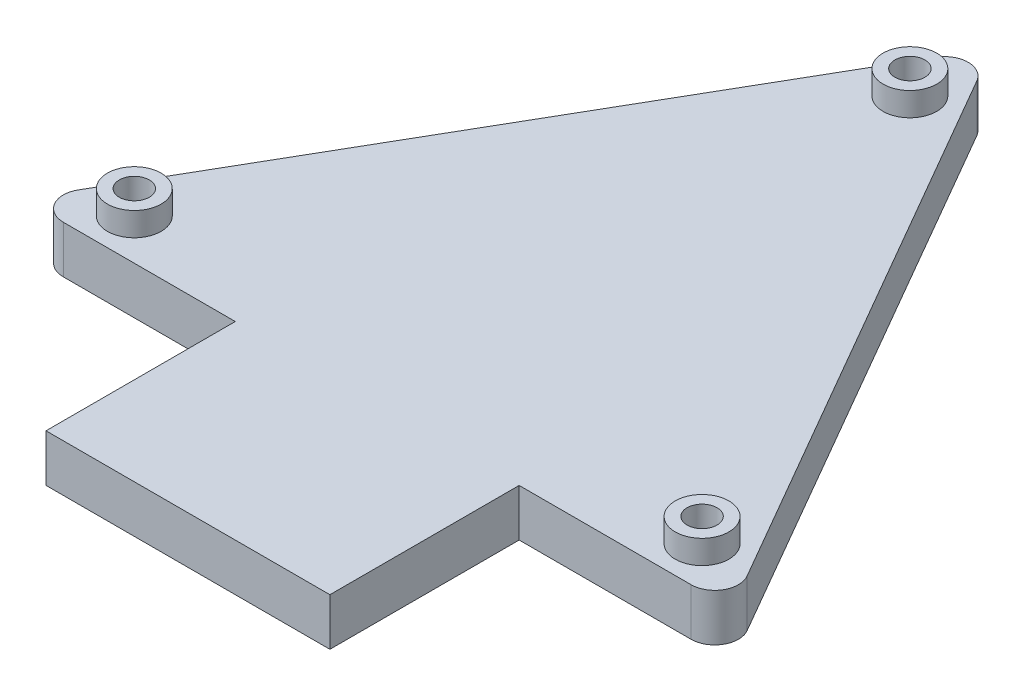
from build123d import *

# Parameters (mm, degrees)
SKETCH1_R           = 3.175
BOSS_EXTRUDE5_DEPTH = 10
SKETCH7_R           = 5.675
SKETCH7_R_2         = 3.175
BOSS_EXTRUDE7_DEPTH = 5


with BuildPart() as part:
    # Sketch1 → Boss-Extrude5 (new body)
    with BuildSketch(Plane(origin=(0, 0, 0), x_dir=(1, 0, 0), z_dir=(0, 1, 0))):
        with BuildLine():
            Line((4.330127019, 7.5), (70.669872981, 122.403810568))
            ThreePointArc((70.669872981, 122.403810568), (75, 124.903810568), (79.330127019, 122.403810568))
            Line((79.330127019, 122.403810568), (145.669872981, 7.5))
            ThreePointArc((145.669872981, 7.5), (145.669873, 2.500000033), (141.339746038, 0))
            Line((141.339746038, 0), (105.000000038, 0))
            Line((105.000000038, 0), (105.000000038, -40))
            Line((105.000000038, -40), (45.000000038, -40))
            Line((45.000000038, -40), (45.000000038, 0))
            Line((45.000000038, 0), (8.660254038, 0))
            ThreePointArc((8.660254038, 0), (4.330127019, 2.5), (4.330127019, 7.5))
        make_face()
        with Locations(Location((75, 112.583302492, 0), (0, 0, 270))):
            Circle(SKETCH1_R, mode=Mode.SUBTRACT)
        with Locations(Location((15, 8.660254038, 0), (0, 0, 270))):
            Circle(SKETCH1_R, mode=Mode.SUBTRACT)
        with Locations(Location((135, 8.660254038, 0), (0, 0, 270))):
            Circle(SKETCH1_R, mode=Mode.SUBTRACT)
    extrude(amount=BOSS_EXTRUDE5_DEPTH)

    # Sketch7 → Boss-Extrude7 (add)
    # profile 1 of 3: a face of its own
    with BuildSketch(Plane(origin=(0, 10, 0), x_dir=(1, 0, 0), z_dir=(0, 1, 0))):
        with Locations(Location((15, 8.660254038, 0), (0, 0, 270))):
            Circle(SKETCH7_R)
        with Locations(Location((15, 8.660254038, 0), (0, 0, 270))):
            Circle(SKETCH7_R_2, mode=Mode.SUBTRACT)
    # profile 2 of 3: a face of its own
    with BuildSketch(Plane(origin=(0, 10, 0), x_dir=(1, 0, 0), z_dir=(0, 1, 0))):
        with Locations(Location((135, 8.660254038, 0), (0, 0, 270))):
            Circle(SKETCH7_R)
        with Locations(Location((135, 8.660254038, 0), (0, 0, 270))):
            Circle(SKETCH7_R_2, mode=Mode.SUBTRACT)
    # profile 3 of 3: a face of its own
    with BuildSketch(Plane(origin=(0, 10, 0), x_dir=(1, 0, 0), z_dir=(0, 1, 0))):
        with Locations(Location((75, 112.583302492, 0), (0, 0, 270))):
            Circle(SKETCH7_R)
        with Locations(Location((75, 112.583302492, 0), (0, 0, 270))):
            Circle(SKETCH7_R_2, mode=Mode.SUBTRACT)
    extrude(amount=BOSS_EXTRUDE7_DEPTH)


solid = part.part
